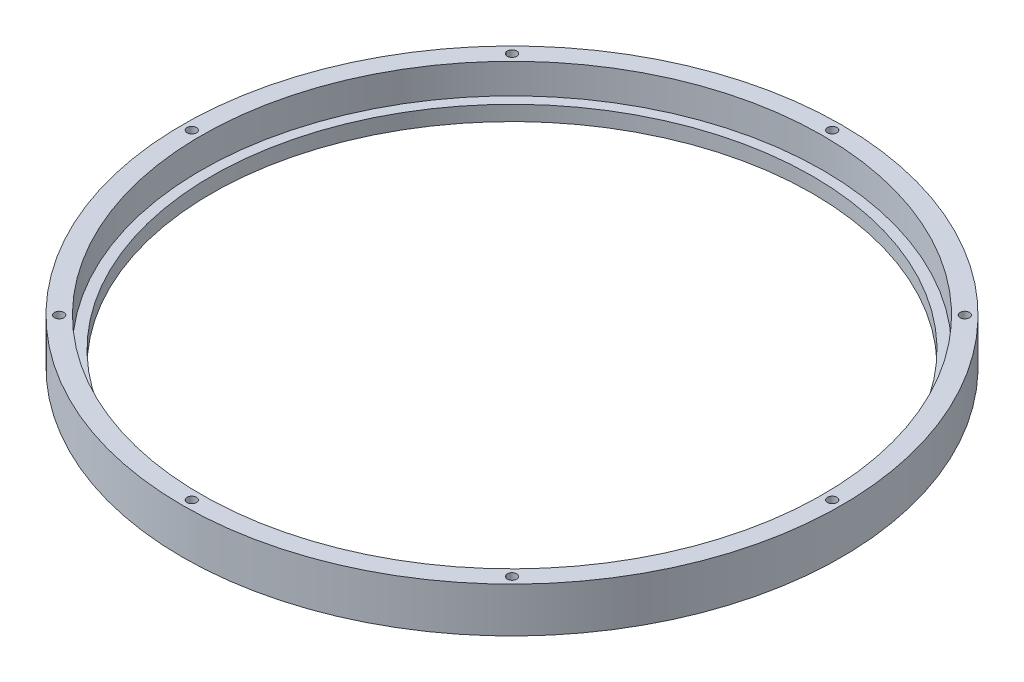
from build123d import *

# Parameters (mm, degrees)
HOLE_WIZARD_M3_1_D = 2.5


with BuildPart() as part:
    # 草图1 → 旋转1 (revolve)
    with BuildSketch(Plane.XY, mode=Mode.PRIVATE) as revolve_1_sk:
        Polygon((80.25, 0), (88, 0), (88, 12), (83, 12), (83, 4), (80.25, 4), align=None)
    revolve(revolve_1_sk.sketch.rotate(Axis((0, 172.855093204, 0), (0, -1, 0)), 90), axis=Axis((0, 172.855093204, 0), (0, -1, 0)))

    # M3 螺纹孔1 (through all)
    with Locations(Plane(origin=(0, 12, 0), x_dir=(1, 0, 0), z_dir=(0, 1, 0))):
        with Locations((-60.457629791, 60.457629791), (-85.5, 0), (0, 85.5), (60.457629791, 60.457629791), (85.5, 0), (60.457629791, -60.457629791), (0, -85.5), (-60.457629791, -60.457629791)):
            Hole(HOLE_WIZARD_M3_1_D / 2)


solid = part.part
